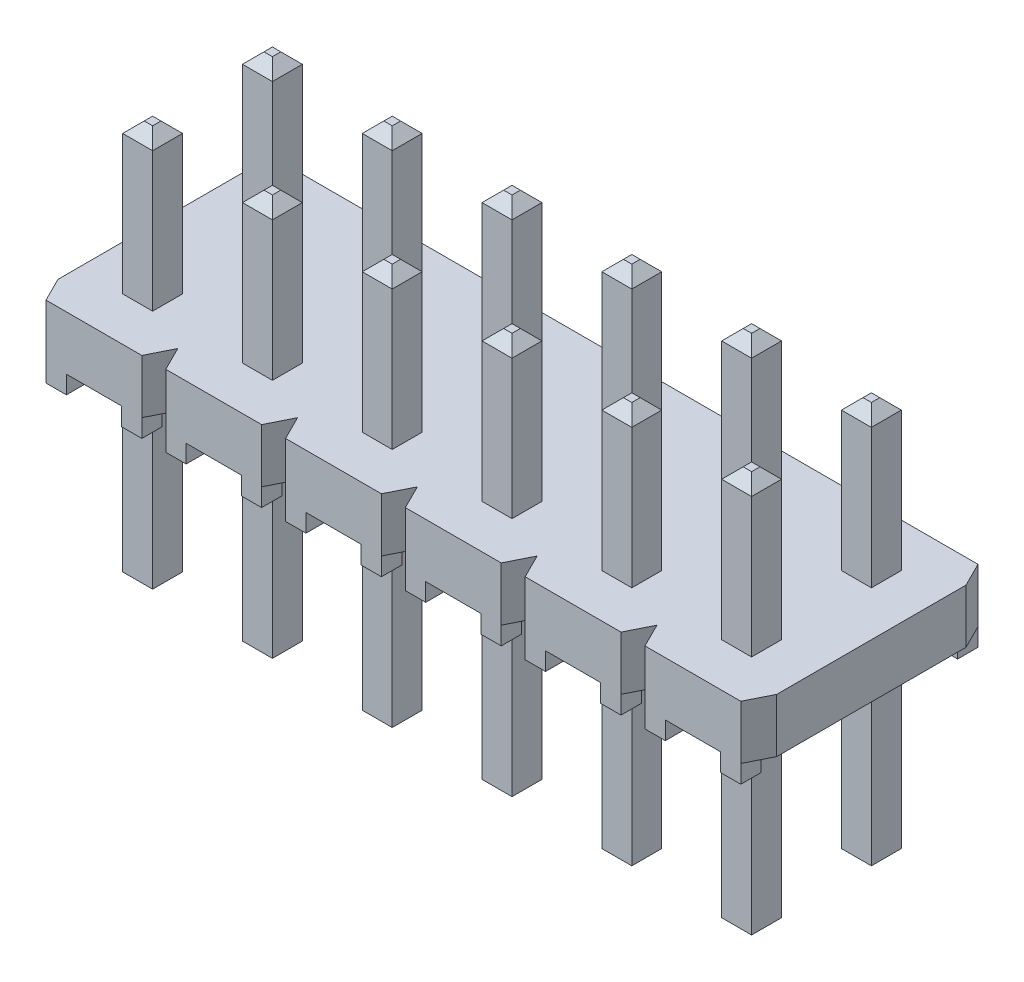
from build123d import *

# Parameters (mm, degrees)
SKETCH1_W                              = 15.24
SKETCH1_H                              = 5.0292
BASE_EXTRUDE_DEPTH                     = 0.5715
SNAP_GROOVES_DEPTH                     = 9.105187361
SKETCH4_W                              = 0.4318
SKETCH4_H                              = 0.4318
STANDOFFS_DEPTH                        = 0.381
POSITION_PATTERN_COUNT                 = 6
POSITION_PATTERN_PITCH                 = 2.54
SKETCH5_W                              = 0.635
SKETCH5_H                              = 8.509
TERMINAL_TH_DEPTH                      = 0.3175
T1_TIP_BOTTOM_SIZE                     = 0.2286
T1_TIP_TOP_SIZE                        = 0.2286
TERMINAL_PATTERN_COUNT                 = 2
TERMINAL_PATTERN_PITCH                 = 2.54
TERMINAL_PATTERN_COUNT_DIR2            = 6
TERMINAL_PATTERN_PITCH_DIR2            = 2.54
T1_TIP_BOTTOM_OF_TERMINAL_PATTERN_SIZE = 0.2286
T1_TIP_TOP_OF_TERMINAL_PATTERN_SIZE    = 0.2286


with BuildPart() as part:
    # Sketch1 → Base-Extrude (new, symmetric)
    with BuildSketch(Plane(origin=(0, 0, 0), x_dir=(1, 0, 0), z_dir=(0, 1, 0))):
        Rectangle(SKETCH1_W, SKETCH1_H)
    extrude(amount=BASE_EXTRUDE_DEPTH, both=True)

    # Sketch3 → Snap Grooves (cut, through all)
    with BuildSketch(Plane(origin=(0, 0.5715, 0), x_dir=(-1, 0, 0), z_dir=(0, 1, 0))):
        Polygon((4.826, 2.5146), (5.334, 2.5146), (5.08, 2.0066), align=None)
        Polygon((4.826, -2.5146), (5.334, -2.5146), (5.08, -2.0066), align=None)
        Polygon((7.62, -2.0066), (7.874, -2.5146), (7.366, -2.5146), align=None)
        Polygon((7.62, 2.0066), (7.874, 2.5146), (7.366, 2.5146), align=None)
    snap_grooves = extrude(amount=-SNAP_GROOVES_DEPTH, mode=Mode.SUBTRACT)

    # Sketch4 → Standoffs (add)
    with BuildSketch(Plane.XZ.offset(0.5715)):
        with Locations((-7.1501, 2.2987)):
            Rectangle(SKETCH4_W, SKETCH4_H)
        with Locations((-5.5499, 2.2987)):
            Rectangle(SKETCH4_W, SKETCH4_H)
        with Locations((-5.5499, -2.2987)):
            Rectangle(SKETCH4_W, SKETCH4_H)
        with Locations((-7.1501, -2.2987)):
            Rectangle(SKETCH4_W, SKETCH4_H)
    standoffs = extrude(amount=STANDOFFS_DEPTH)

    # Position Pattern: Snap Grooves, Standoffs ×6
    with Locations(*[(i * POSITION_PATTERN_PITCH, 0, 0) for i in range(1, POSITION_PATTERN_COUNT)]):
        add(snap_grooves, mode=Mode.SUBTRACT)
        add(standoffs)

    # Sketch5 → Terminal -TH (add, symmetric)
    with BuildSketch(Plane.ZY.offset(6.35)):
        with Locations((1.27, -0.508)):
            Rectangle(SKETCH5_W, SKETCH5_H)
    terminal_th = extrude(amount=TERMINAL_TH_DEPTH, both=True)

    # T1 Tip Bottom
    t1_tip_bottom_edges = [part.edges().sort_by_distance(p)[0] for p in [
        (-6.35, -4.7625, 1.5875),
        (-6.6675, -4.7625, 1.27),
        (-6.0325, -4.7625, 1.27),
        (-6.35, -4.7625, 0.9525),
    ]]
    chamfer(t1_tip_bottom_edges, length=T1_TIP_BOTTOM_SIZE)

    # T1 Tip Top
    t1_tip_top_edges = [part.edges().sort_by_distance(p)[0] for p in [
        (-6.35, 3.7465, 0.9525),
        (-6.0325, 3.7465, 1.27),
        (-6.35, 3.7465, 1.5875),
        (-6.6675, 3.7465, 1.27),
    ]]
    chamfer(t1_tip_top_edges, length=T1_TIP_TOP_SIZE)

    # Terminal Pattern: Terminal -TH 2 × 6
    with Locations(*[(j * TERMINAL_PATTERN_PITCH_DIR2, 0, -i * TERMINAL_PATTERN_PITCH) for i in range(TERMINAL_PATTERN_COUNT) for j in range(TERMINAL_PATTERN_COUNT_DIR2) if (i, j) != (0, 0)]):
        add(terminal_th)

    # T1 Tip Bottom of Terminal Pattern
    t1_tip_bottom_of_terminal_pattern_edges = [part.edges().sort_by_distance(p)[0] for p in [
        (-3.81, -4.7625, 1.5875),
        (-4.1275, -4.7625, 1.27),
        (-3.4925, -4.7625, 1.27),
        (-3.81, -4.7625, 0.9525),
        (-1.27, -4.7625, 1.5875),
        (-1.5875, -4.7625, 1.27),
        (-0.9525, -4.7625, 1.27),
        (-1.27, -4.7625, 0.9525),
        (1.27, -4.7625, 1.5875),
        (0.9525, -4.7625, 1.27),
        (1.5875, -4.7625, 1.27),
        (1.27, -4.7625, 0.9525),
        (3.81, -4.7625, 1.5875),
        (3.4925, -4.7625, 1.27),
        (4.1275, -4.7625, 1.27),
        (3.81, -4.7625, 0.9525),
        (6.35, -4.7625, 1.5875),
        (6.0325, -4.7625, 1.27),
        (6.6675, -4.7625, 1.27),
        (6.35, -4.7625, 0.9525),
        (-6.35, -4.7625, -0.9525),
        (-6.6675, -4.7625, -1.27),
        (-6.0325, -4.7625, -1.27),
        (-6.35, -4.7625, -1.5875),
        (-3.81, -4.7625, -0.9525),
        (-4.1275, -4.7625, -1.27),
        (-3.4925, -4.7625, -1.27),
        (-3.81, -4.7625, -1.5875),
        (-1.27, -4.7625, -0.9525),
        (-1.5875, -4.7625, -1.27),
        (-0.9525, -4.7625, -1.27),
        (-1.27, -4.7625, -1.5875),
        (1.27, -4.7625, -0.9525),
        (0.9525, -4.7625, -1.27),
        (1.5875, -4.7625, -1.27),
        (1.27, -4.7625, -1.5875),
        (3.81, -4.7625, -0.9525),
        (3.4925, -4.7625, -1.27),
        (4.1275, -4.7625, -1.27),
        (3.81, -4.7625, -1.5875),
        (6.35, -4.7625, -0.9525),
        (6.0325, -4.7625, -1.27),
        (6.6675, -4.7625, -1.27),
        (6.35, -4.7625, -1.5875),
    ]]
    chamfer(t1_tip_bottom_of_terminal_pattern_edges, length=T1_TIP_BOTTOM_OF_TERMINAL_PATTERN_SIZE)

    # T1 Tip Top of Terminal Pattern
    t1_tip_top_of_terminal_pattern_edges = [part.edges().sort_by_distance(p)[0] for p in [
        (-3.81, 3.7465, 0.9525),
        (-3.4925, 3.7465, 1.27),
        (-3.81, 3.7465, 1.5875),
        (-4.1275, 3.7465, 1.27),
        (-1.27, 3.7465, 0.9525),
        (-0.9525, 3.7465, 1.27),
        (-1.27, 3.7465, 1.5875),
        (-1.5875, 3.7465, 1.27),
        (1.27, 3.7465, 0.9525),
        (1.5875, 3.7465, 1.27),
        (1.27, 3.7465, 1.5875),
        (0.9525, 3.7465, 1.27),
        (3.81, 3.7465, 0.9525),
        (4.1275, 3.7465, 1.27),
        (3.81, 3.7465, 1.5875),
        (3.4925, 3.7465, 1.27),
        (6.35, 3.7465, 0.9525),
        (6.6675, 3.7465, 1.27),
        (6.35, 3.7465, 1.5875),
        (6.0325, 3.7465, 1.27),
        (-6.35, 3.7465, -1.5875),
        (-6.0325, 3.7465, -1.27),
        (-6.35, 3.7465, -0.9525),
        (-6.6675, 3.7465, -1.27),
        (-3.81, 3.7465, -1.5875),
        (-3.4925, 3.7465, -1.27),
        (-3.81, 3.7465, -0.9525),
        (-4.1275, 3.7465, -1.27),
        (-1.27, 3.7465, -1.5875),
        (-0.9525, 3.7465, -1.27),
        (-1.27, 3.7465, -0.9525),
        (-1.5875, 3.7465, -1.27),
        (1.27, 3.7465, -1.5875),
        (1.5875, 3.7465, -1.27),
        (1.27, 3.7465, -0.9525),
        (0.9525, 3.7465, -1.27),
        (3.81, 3.7465, -1.5875),
        (4.1275, 3.7465, -1.27),
        (3.81, 3.7465, -0.9525),
        (3.4925, 3.7465, -1.27),
        (6.35, 3.7465, -1.5875),
        (6.6675, 3.7465, -1.27),
        (6.35, 3.7465, -0.9525),
        (6.0325, 3.7465, -1.27),
    ]]
    chamfer(t1_tip_top_of_terminal_pattern_edges, length=T1_TIP_TOP_OF_TERMINAL_PATTERN_SIZE)


solid = part.part
